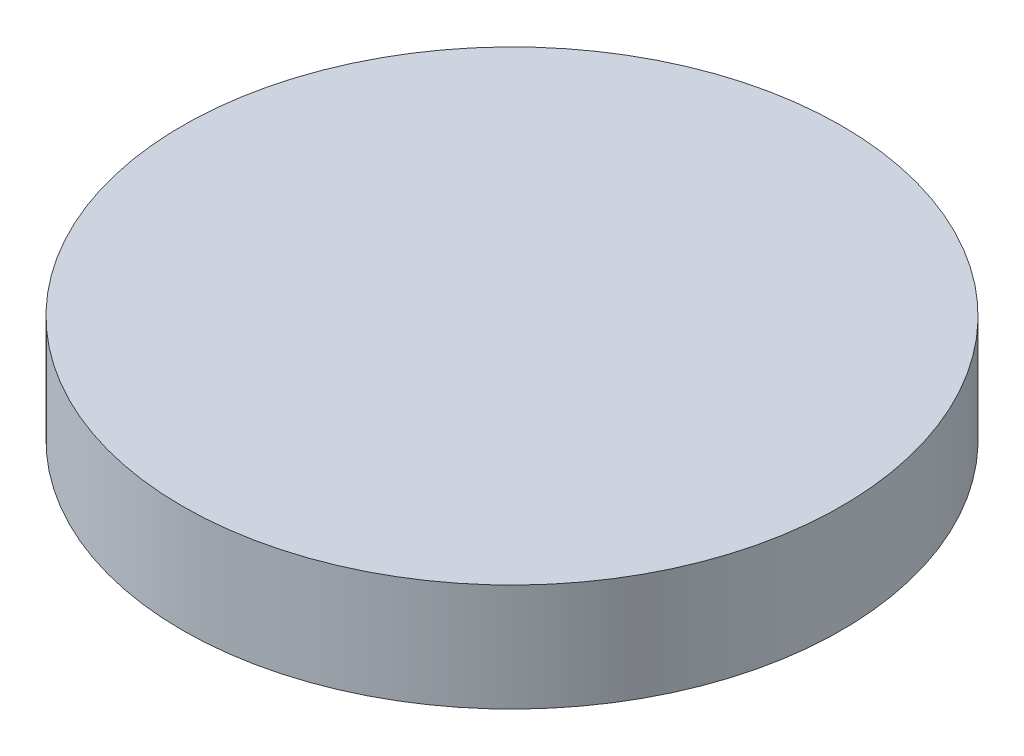
from build123d import *

# Parameters (mm, degrees)
SKETCH1_R           = 67.5
BOSS_EXTRUDE1_DEPTH = 22


with BuildPart() as part:
    # Sketch1 → Boss-Extrude1 (new body)
    with BuildSketch(Plane(origin=(0, 0, 0), x_dir=(1, 0, 0), z_dir=(0, 1, 0))):
        with Locations(Location((0, 0, 0), (0, 0, 270))):
            Circle(SKETCH1_R)
    extrude(amount=BOSS_EXTRUDE1_DEPTH)


solid = part.part
